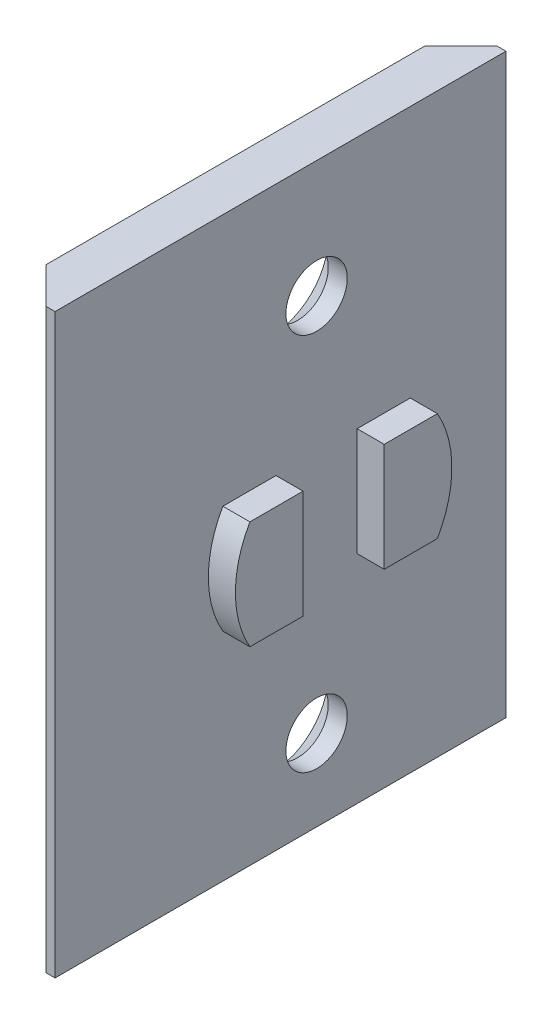
from build123d import *

# Parameters (mm, degrees)
SKETCH_1_W                 = 25
SKETCH_1_H                 = 32
EXTRUDE_1_DEPTH            = 2.5
CHAMFER_1_SIZE             = 2
HOLE_WIZARD_M31_AT_2_COUNT = 2
HOLE_WIZARD_M31_AT_2_PITCH = 21
SKETCH_4_R                 = 6
EXTRUDE_2_DEPTH            = 1.5
SKETCH_5_W                 = 4.5
SKETCH_5_H                 = 16
CUT_EXTRUDE_1_DEPTH        = 1.5
CUT_EXTRUDE_START          = -1.5
CUT_EXTRUDE_2_DEPTH        = 1.5


with BuildPart() as part:
    # Эскиз1 → Бобышка-Вытянуть1 (new body)
    with BuildSketch(Plane(origin=(0, 0, 0), x_dir=(0, 0, -1), z_dir=(1, 0, 0))):
        Rectangle(SKETCH_1_W, SKETCH_1_H)
    extrude(amount=EXTRUDE_1_DEPTH)

    # Фаска1
    chamfer_1_edges = [part.edges().sort_by_distance(p)[0] for p in [
        (0, 0, 12.5),
        (0, 0, -12.5),
    ]]
    chamfer(chamfer_1_edges, length=CHAMFER_1_SIZE)

    # Эскиз3 → Зенковка для  винта с плоской головкой M31 (revolve, cut)
    with BuildSketch(Plane(origin=(0, -11.5, -2), x_dir=(0, 0, 1), z_dir=(0, 1, 0))):
        Polygon((0, 0), (0, 2.5), (1.7, 2.5), (1.7, 1.45), (3.15, 0), align=None)
    hole_wizard_m31 = revolve(axis=Axis((-6.35, -11.5, -2), (1, 0, 0)), mode=Mode.SUBTRACT)

    # Зенковка для  винта с плоской головкой M31 at 2: Зенковка для  винта с плоской головкой M31 ×2
    with Locations(*[(0, i * HOLE_WIZARD_M31_AT_2_PITCH, 0) for i in range(1, HOLE_WIZARD_M31_AT_2_COUNT)]):
        add(hole_wizard_m31, mode=Mode.SUBTRACT)

    # Эскиз4 → Бобышка-Вытянуть2 (add)
    with BuildSketch(Plane(origin=(2.5, 0, 0), x_dir=(0, 0, -1), z_dir=(1, 0, 0))):
        with Locations(Location((2, -1, 0), (0, 0, 180))):
            Circle(SKETCH_4_R)
        with BuildLine():
            Line((-0.25, 1.7), (-0.227105745, 1.7))
            ThreePointArc((-0.227105745, 1.7), (2, 2.5), (4.227105745, 1.7))
            Line((4.227105745, 1.7), (4.25, 1.7))
            Line((4.25, 1.7), (4.25, -3.7))
            Line((4.25, -3.7), (4.227105745, -3.7))
            ThreePointArc((4.227105745, -3.7), (2, -4.5), (-0.227105745, -3.7))
            Line((-0.227105745, -3.7), (-0.25, -3.7))
            Line((-0.25, -3.7), (-0.25, 1.7))
        make_face(mode=Mode.SUBTRACT)
    extrude(amount=EXTRUDE_2_DEPTH)

    # Эскиз5 → Вырез-Вытянуть1 (cut)
    with BuildSketch(Plane(origin=(4, 0, 0), x_dir=(0, 0, -1), z_dir=(1, 0, 0))):
        with Locations((2, -1)):
            Rectangle(SKETCH_5_W, SKETCH_5_H)
    extrude(amount=-CUT_EXTRUDE_1_DEPTH, mode=Mode.SUBTRACT)

    # Эскиз6 → Вырез-Вытянуть2 (cut)
    with BuildSketch(Plane(origin=(4, 0, 0), x_dir=(0, 0, -1), z_dir=(1, 0, 0)).offset(CUT_EXTRUDE_START)):
        with BuildLine():
            ThreePointArc((4.25, 4.562148865), (0.047794779, 4.67352578), (-3.196152423, 2))
            Line((-3.196152423, 2), (4.25, 2))
            Line((4.25, 2), (4.25, 4.562148865))
        make_face()
        with BuildLine():
            Line((4.25, 4.562148865), (4.25, 2))
            Line((4.25, 2), (7.196152423, 2))
            ThreePointArc((7.196152423, 2), (5.937314844, 3.527422205), (4.25, 4.562148865))
        make_face()
        with BuildLine():
            Line((4.25, -4), (-3.196152423, -4))
            ThreePointArc((-3.196152423, -4), (0.047794779, -6.67352578), (4.25, -6.562148865))
            Line((4.25, -6.562148865), (4.25, -4))
        make_face()
        with BuildLine():
            Line((7.196152423, -4), (4.25, -4))
            Line((4.25, -4), (4.25, -6.562148865))
            ThreePointArc((4.25, -6.562148865), (5.937314844, -5.527422205), (7.196152423, -4))
        make_face()
    extrude(amount=CUT_EXTRUDE_2_DEPTH, mode=Mode.SUBTRACT)


solid = part.part
